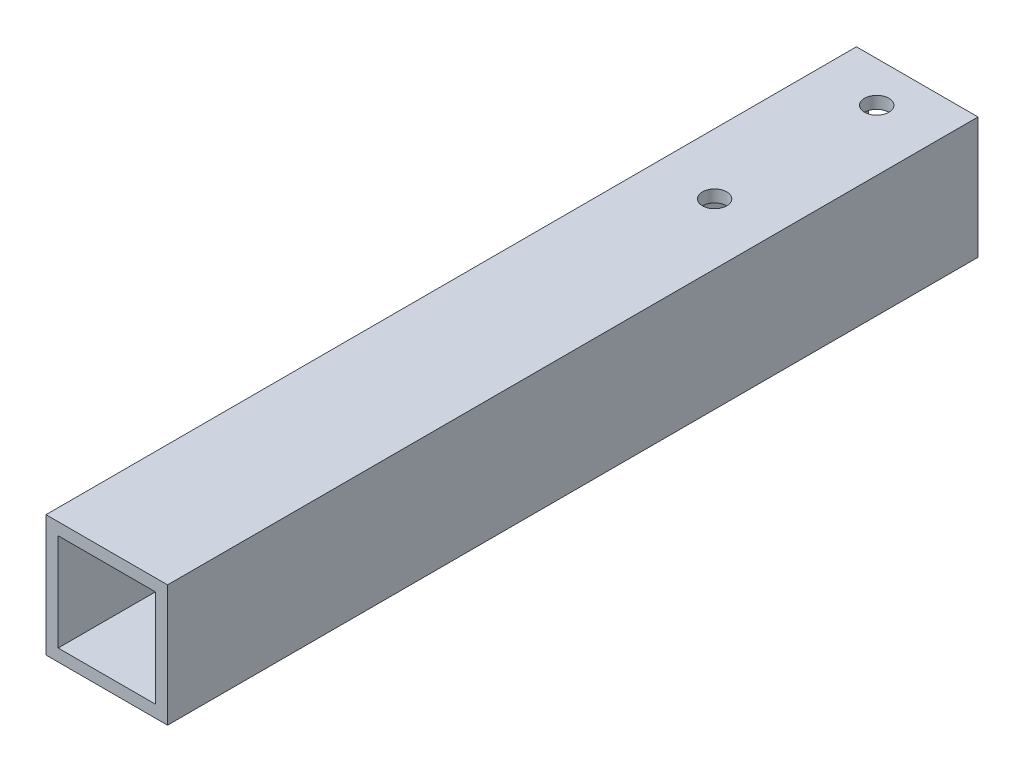
from build123d import *

# Parameters (mm, degrees)
ESQUISSE1_W                = 15
ESQUISSE1_H                = 15
EXTRUSION1_DEPTH           = 100
ESQUISSE2_W                = 12
ESQUISSE2_H                = 12
EXTRUSION2_DEPTH           = 101.560926806
ESQUISSE3_R                = 1.5
EXTRUSION3_DEPTH           = 102.396498953
R_P_TITION_LIN_AIRE1_COUNT = 2
R_P_TITION_LIN_AIRE1_PITCH = 20


with BuildPart() as part:
    # Esquisse1 → Extrusion1 (new body)
    with BuildSketch(Plane.XY):
        Rectangle(ESQUISSE1_W, ESQUISSE1_H)
    extrude(amount=EXTRUSION1_DEPTH)

    # Esquisse2 → Extrusion2 (cut, through all)
    with BuildSketch(Plane.XY.offset(100)):
        Rectangle(ESQUISSE2_W, ESQUISSE2_H)
    extrude(amount=-EXTRUSION2_DEPTH, mode=Mode.SUBTRACT)

    # Esquisse3 → Extrusion3 (cut, through all)
    with BuildSketch(Plane(origin=(0, 7.5, 0), x_dir=(1, 0, 0), z_dir=(0, 1, 0))):
        with Locations(Location((0, -5, 0), (0, 0, 270))):
            Circle(ESQUISSE3_R)
    extrusion3 = extrude(amount=-EXTRUSION3_DEPTH, mode=Mode.SUBTRACT)

    # Répétition linéaire1: Extrusion3 ×2
    with Locations(*[(0, 0, i * R_P_TITION_LIN_AIRE1_PITCH) for i in range(1, R_P_TITION_LIN_AIRE1_COUNT)]):
        add(extrusion3, mode=Mode.SUBTRACT)


solid = part.part
